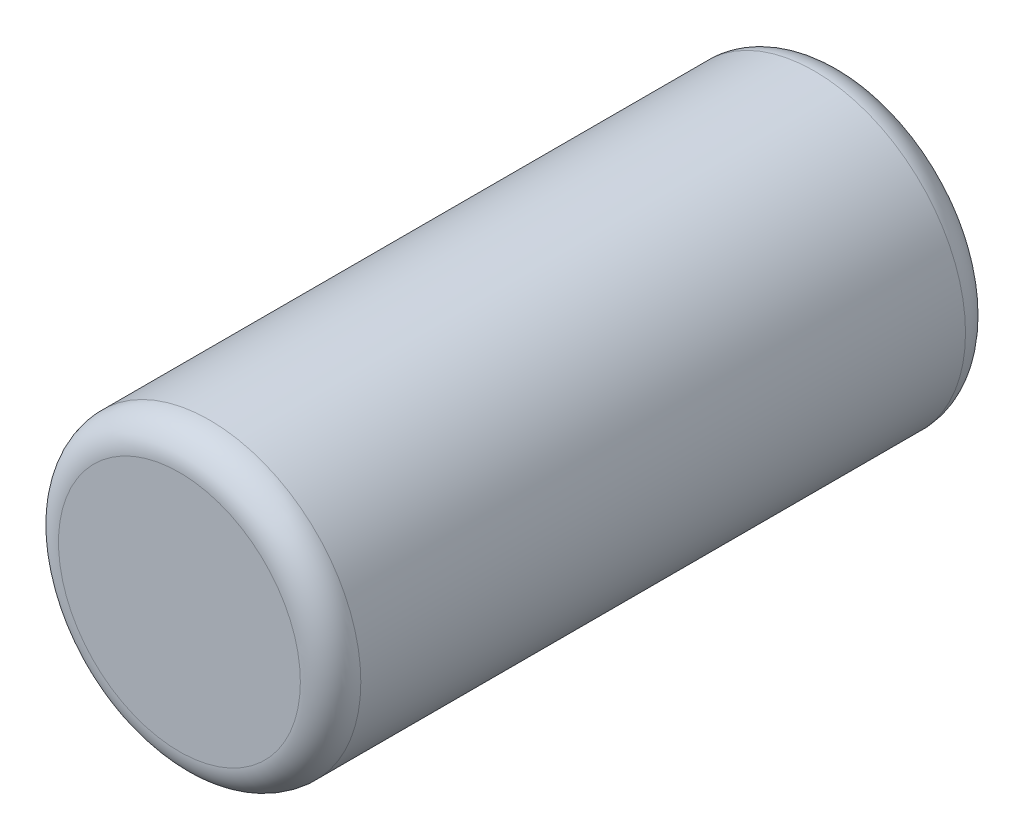
from build123d import *

# Parameters (mm, degrees)
SKETCH1_R           = 5
BOSS_EXTRUDE1_DEPTH = 22
FILLET3_R           = 1


with BuildPart() as part:
    # Sketch1 → Boss-Extrude1 (new body)
    with BuildSketch(Plane.XY):
        Circle(SKETCH1_R)
    extrude(amount=BOSS_EXTRUDE1_DEPTH)

    # Fillet3
    fillet3_edges = [part.edges().sort_by_distance(p)[0] for p in [
        (-5, 0, 0),
        (-5, 0, 22),
    ]]
    fillet(fillet3_edges, radius=FILLET3_R)


solid = part.part
